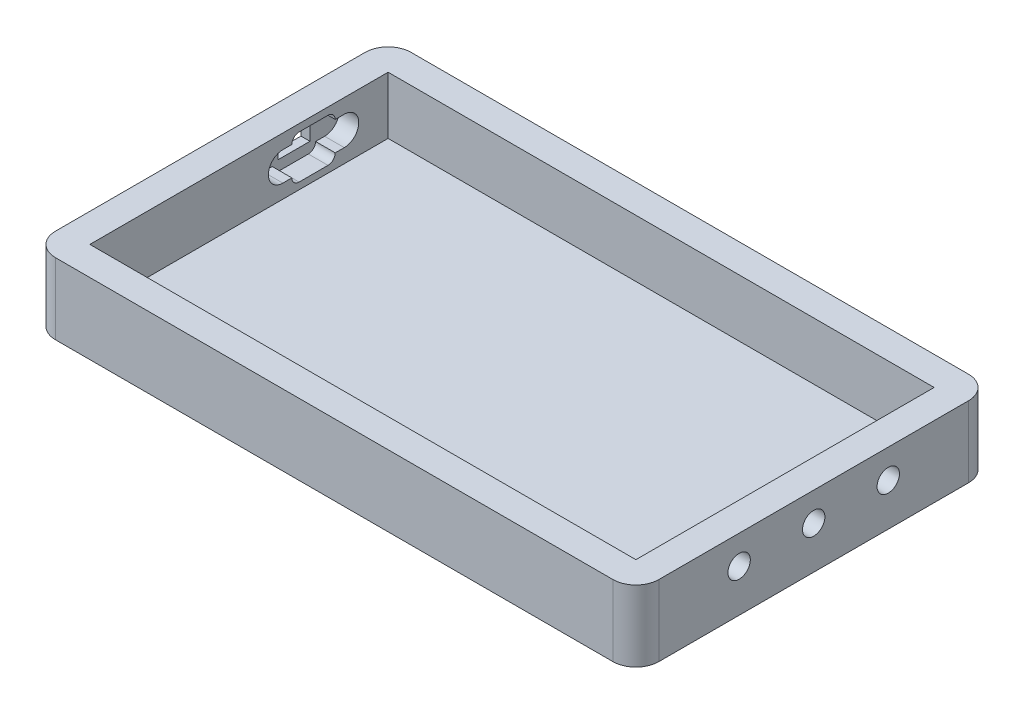
from build123d import *

# Parameters (mm, degrees)
SKETCH1_W           = 151.13
SKETCH1_H           = 82.55
BOSS_EXTRUDE1_DEPTH = 15.875
SKETCH2_W           = 167.005
SKETCH2_H           = 98.425
BOSS_EXTRUDE2_DEPTH = 3.81
FILLET2_R           = 6.35
CUT_EXTRUDE1_DEPTH  = 184.691243225
CUT_EXTRUDE3_DEPTH  = 5.4356
SKETCH5_W           = 8.89
SKETCH5_H           = 6.35
CUT_EXTRUDE4_DEPTH  = 189.417815482


with BuildPart() as part:
    # Sketch1 → Boss-Extrude1 (new body)
    with BuildSketch(Plane(origin=(0, 0, 0), x_dir=(1, 0, 0), z_dir=(0, 1, 0))):
        Polygon((-7.9375, 82.55), (-7.9375, -7.9375), (159.0675, -7.9375), (159.0675, 90.4875), (-7.9375, 90.4875), align=None)
        with Locations((75.565, 41.275)):
            Rectangle(SKETCH1_W, SKETCH1_H, mode=Mode.SUBTRACT)
    extrude(amount=BOSS_EXTRUDE1_DEPTH)

    # Sketch2 → Boss-Extrude2 (add)
    with BuildSketch(Plane.XZ):
        with Locations((75.565, -41.275)):
            Rectangle(SKETCH2_W, SKETCH2_H)
    extrude(amount=BOSS_EXTRUDE2_DEPTH)

    # Fillet2
    fillet2_edges = [part.edges().sort_by_distance(p)[0] for p in [
        (-7.9375, 6.0325, 7.9375),
        (-7.9375, 6.0325, -90.4875),
        (159.0675, 6.0325, -90.4875),
        (159.0675, 6.0325, 7.9375),
    ]]
    fillet(fillet2_edges, radius=FILLET2_R)

    # Sketch3 → Cut-Extrude1 (cut, through all)
    with BuildSketch(Plane.ZY.offset(-151.13)):
        with BuildLine():
            ThreePointArc((-58.8137, 7.9375), (-61.9125, 11.0363), (-65.0113, 7.9375))
            Line((-65.0113, 7.9375), (-58.8137, 7.9375))
        make_face()
        with BuildLine():
            Line((-58.8137, 7.9375), (-65.0113, 7.9375))
            ThreePointArc((-65.0113, 7.9375), (-61.9125, 4.8387), (-58.8137, 7.9375))
        make_face()
        with BuildLine():
            Line((-41.275, 7.9375), (-41.275, 11.0363))
            ThreePointArc((-41.275, 11.0363), (-43.466182494, 10.128682494), (-44.3738, 7.9375))
            Line((-44.3738, 7.9375), (-41.275, 7.9375))
        make_face()
        with BuildLine():
            Line((-41.275, 4.8387), (-41.275, 7.9375))
            Line((-41.275, 7.9375), (-44.3738, 7.9375))
            ThreePointArc((-44.3738, 7.9375), (-43.466182494, 5.746317506), (-41.275, 4.8387))
        make_face()
        with BuildLine():
            ThreePointArc((-38.1762, 7.9375), (-39.083817506, 10.128682494), (-41.275, 11.0363))
            Line((-41.275, 11.0363), (-41.275, 7.9375))
            Line((-41.275, 7.9375), (-38.1762, 7.9375))
        make_face()
        with BuildLine():
            Line((-38.1762, 7.9375), (-41.275, 7.9375))
            Line((-41.275, 7.9375), (-41.275, 4.8387))
            ThreePointArc((-41.275, 4.8387), (-39.083817506, 5.746317506), (-38.1762, 7.9375))
        make_face()
        with BuildLine():
            ThreePointArc((-23.7363, 7.9375), (-20.6375, 4.8387), (-17.5387, 7.9375))
            Line((-17.5387, 7.9375), (-23.7363, 7.9375))
        make_face()
        with BuildLine():
            Line((-23.7363, 7.9375), (-17.5387, 7.9375))
            ThreePointArc((-17.5387, 7.9375), (-20.6375, 11.0363), (-23.7363, 7.9375))
        make_face()
    extrude(amount=-CUT_EXTRUDE1_DEPTH, mode=Mode.SUBTRACT)

    # Sketch4 → Cut-Extrude3 (cut)
    with BuildSketch(Plane(origin=(0, 0, 0), x_dir=(0, 0, -1), z_dir=(1, 0, 0))):
        with BuildLine():
            Line((57.912502484, 13.869404287), (65.912502516, 13.869404287))
            ThreePointArc((65.912502516, 13.869404287), (67.326716079, 13.28361785), (67.912502516, 11.869404287))
            Line((67.912502516, 11.869404287), (70.412502516, 11.869404287))
            ThreePointArc((70.412502516, 11.869404287), (74.412502516, 7.869404287), (70.412502516, 3.869404287))
            Line((70.412502516, 3.869404287), (67.912502516, 3.869404287))
            ThreePointArc((67.912502516, 3.869404287), (67.326716079, 2.455190725), (65.912502516, 1.869404287))
            Line((65.912502516, 1.869404287), (57.912502484, 1.869404287))
            ThreePointArc((57.912502484, 1.869404287), (56.498288921, 2.455190725), (55.912502484, 3.869404287))
            Line((55.912502484, 3.869404287), (53.412502484, 3.869404287))
            ThreePointArc((53.412502484, 3.869404287), (49.412502484, 7.869404287), (53.412502484, 11.869404287))
            Line((53.412502484, 11.869404287), (55.912502484, 11.869404287))
            ThreePointArc((55.912502484, 11.869404287), (56.498288921, 13.28361785), (57.912502484, 13.869404287))
        make_face()
    extrude(amount=-CUT_EXTRUDE3_DEPTH, mode=Mode.SUBTRACT)

    # Sketch5 → Cut-Extrude4 (cut, through all)
    with BuildSketch(Plane(origin=(-5.4356, 0, 0), x_dir=(0, 0, -1), z_dir=(1, 0, 0))):
        with Locations((61.9125025, 7.869404287)):
            Rectangle(SKETCH5_W, SKETCH5_H)
    extrude(amount=-CUT_EXTRUDE4_DEPTH, mode=Mode.SUBTRACT)


solid = part.part
